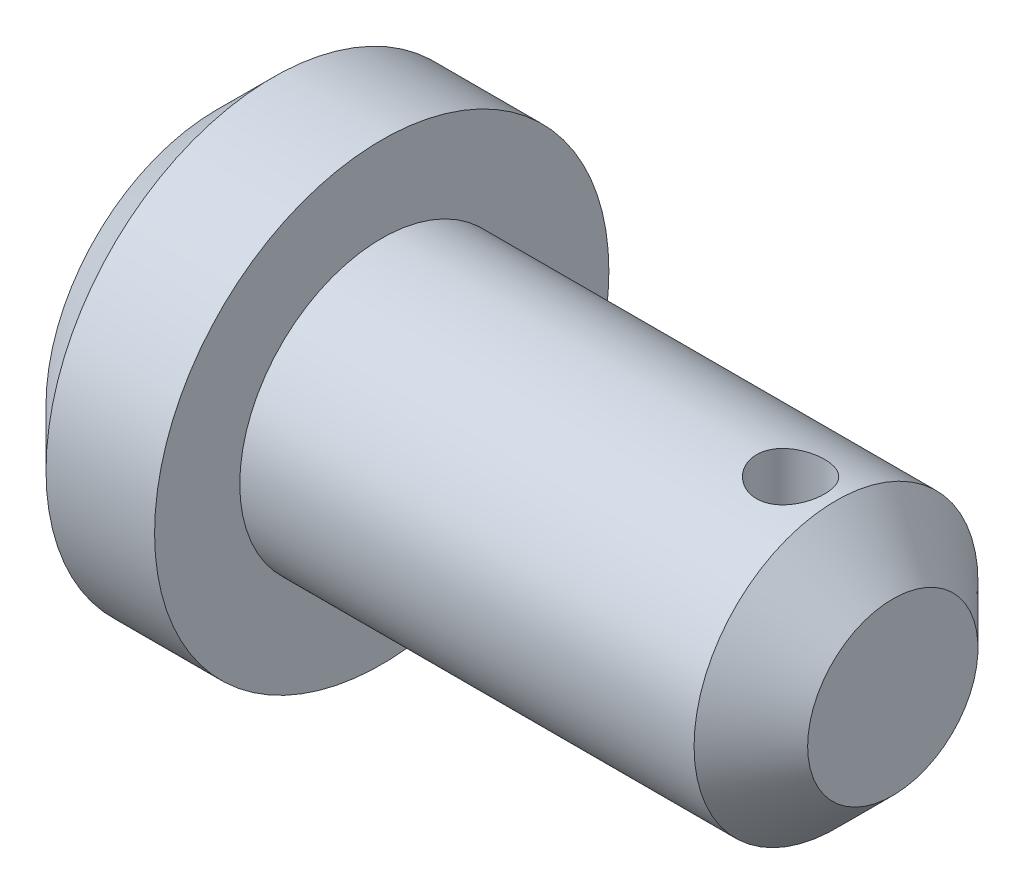
from build123d import *

# Parameters (mm, degrees)
CUT_EXTRUDE3_DEPTH      = 107.301458127
CUT_EXTRUDE3_DEPTH_BACK = 107.301458127
SKETCH4_R               = 6


with BuildPart() as part:
    # Sketch1 → Revolve2 (revolve)
    with BuildSketch(Plane(origin=(0, 0, 0), x_dir=(1, 0, 0), z_dir=(0, 1, 0)), mode=Mode.PRIVATE) as revolve2_sk:
        Polygon((0, 25), (0, 40), (-19.12049302, 40), (-29.12049302, 30), (-29.12049302, 0), (0, 0), (90, 0), (90, 15), (80, 25), align=None)
    revolve(revolve2_sk.sketch.rotate(Axis((0, 0, 0), (1, 0, 0)), 180), axis=Axis((0, 0, 0), (1, 0, 0)))

    # Sketch4 → Cut-Extrude3 (cut, two sides: drawn at the far end of the back side and taken through both)
    with BuildSketch(Plane(origin=(0, 0, 0), x_dir=(1, 0, 0), z_dir=(0, 1, 0)).offset(-CUT_EXTRUDE3_DEPTH_BACK)):
        with Locations(Location((72, 0, 0), (0, 0, 270))):
            Circle(SKETCH4_R)
    extrude(amount=CUT_EXTRUDE3_DEPTH + CUT_EXTRUDE3_DEPTH_BACK, mode=Mode.SUBTRACT)


solid = part.part
